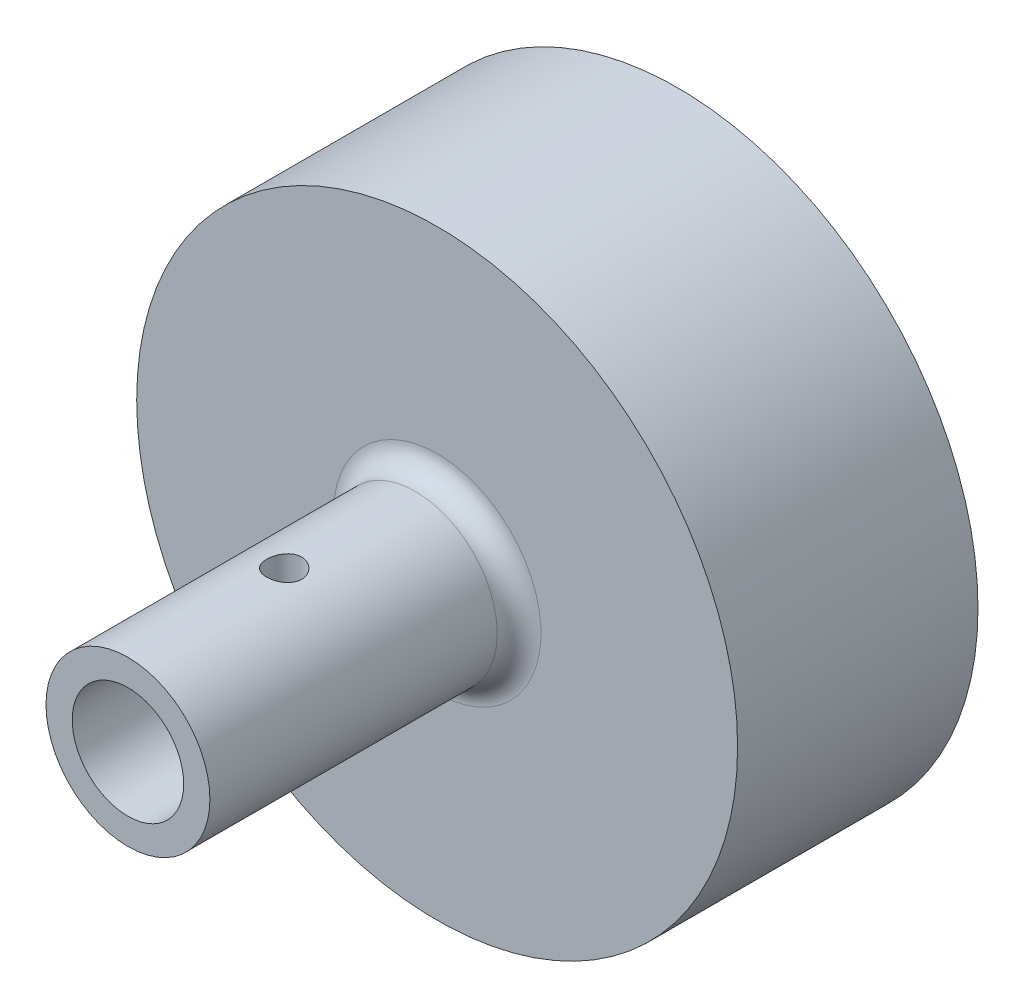
from build123d import *

# Parameters (mm, degrees)
SKETCH1_R           = 7.5
SKETCH1_R_2         = 5.1
BOSS_EXTRUDE1_DEPTH = 28.3
SKETCH4_R           = 27.5
BOSS_EXTRUDE3_DEPTH = 22
FILLET1_R           = 2
SKETCH5_R           = 2.125
CUT_EXTRUDE2_DEPTH  = 20
BOSS_EXTRUDE4_DEPTH = 20
SKETCH7_R           = 1.6
CUT_EXTRUDE3_DEPTH  = 15


with BuildPart() as part:
    # Sketch1 → Boss-Extrude1 (new body)
    with BuildSketch(Plane.XY):
        Circle(SKETCH1_R)
        Circle(SKETCH1_R_2, mode=Mode.SUBTRACT)
    extrude(amount=BOSS_EXTRUDE1_DEPTH)

    # Sketch4 → Boss-Extrude3 (add)
    with BuildSketch(Plane(origin=(0, 0, 0), x_dir=(-1, 0, 0), z_dir=(0, 0, -1))):
        Circle(SKETCH4_R)
    extrude(amount=BOSS_EXTRUDE3_DEPTH)

    # Fillet1
    fillet1_edges = [part.edges().sort_by_distance(p)[0] for p in [
        (-7.5, 0, 0),
    ]]
    fillet(fillet1_edges, radius=FILLET1_R)

    # Sketch5 → Cut-Extrude2 (cut)
    with BuildSketch(Plane(origin=(0, 0, -22), x_dir=(-1, 0, 0), z_dir=(0, 0, -1))):
        with Locations((0, 12)):
            Circle(SKETCH5_R)
        with Locations((12, 0)):
            Circle(SKETCH5_R)
        with Locations((0, -12)):
            Circle(SKETCH5_R)
        with Locations((-12, 0)):
            Circle(SKETCH5_R)
    extrude(amount=-CUT_EXTRUDE2_DEPTH, mode=Mode.SUBTRACT)

    # Sketch6 → Boss-Extrude4 (add)
    with BuildSketch(Plane.XY):
        with BuildLine():
            ThreePointArc((3.163858404, 4), (0, 5.1), (-3.163858404, 4))
            Line((-3.163858404, 4), (3.163858404, 4))
        make_face()
    extrude(amount=BOSS_EXTRUDE4_DEPTH)

    # Sketch7 → Cut-Extrude3 (cut)
    with BuildSketch(Plane(origin=(0, 0, 0), x_dir=(1, 0, 0), z_dir=(0, 1, 0))):
        with Locations(Location((0, -14, 0), (0, 0, 90))):
            Circle(SKETCH7_R)
    extrude(amount=CUT_EXTRUDE3_DEPTH, mode=Mode.SUBTRACT)


solid = part.part
